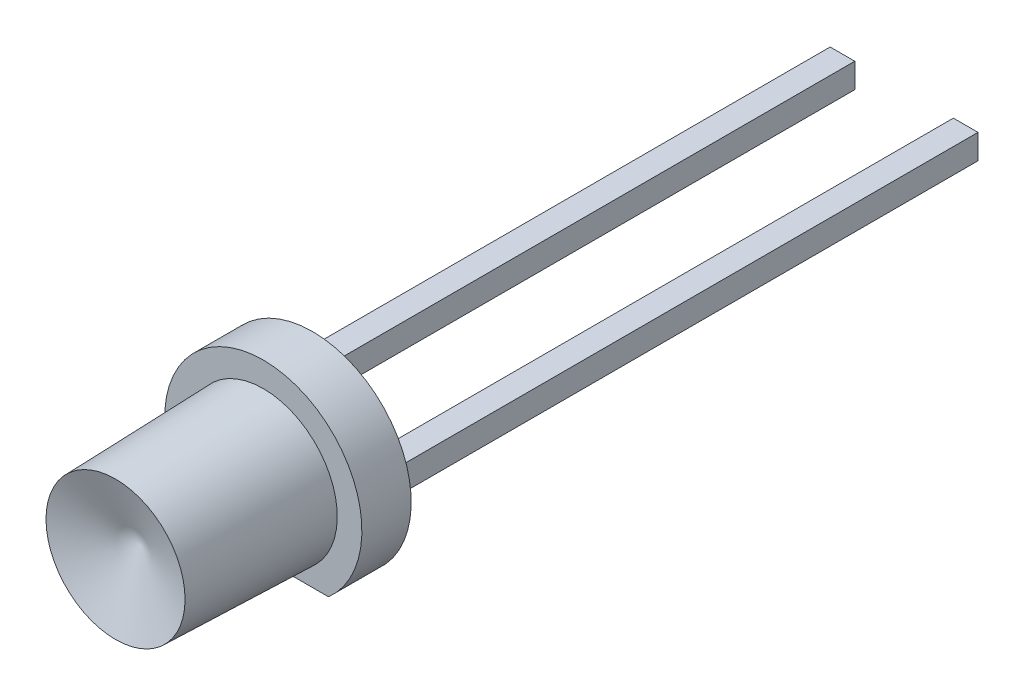
from build123d import *

# Parameters (mm, degrees)
BOSS_EXTRUDE1_DEPTH        = 10
BOSS_EXTRUDE1_DEPTH_BACK   = 2
SKETCH1_W                  = 0.5
SKETCH1_H                  = 0.5
BOSS_EXTRUDE1_2_DEPTH      = 10
BOSS_EXTRUDE1_2_DEPTH_BACK = 2
SKETCH2_R                  = 2
BOSS_EXTRUDE2_DEPTH        = 1
CUT_EXTRUDE1_DEPTH         = 3


with BuildPart() as part:
    # Sketch1 → Boss-Extrude1 (new, two sides: drawn at the far end of the back side and taken through both)
    with BuildSketch(Plane.XY.offset(-BOSS_EXTRUDE1_DEPTH_BACK)):
        with Locations((-0.25, -0.25)):
            Rectangle(SKETCH1_W, SKETCH1_H)
    extrude(amount=BOSS_EXTRUDE1_DEPTH + BOSS_EXTRUDE1_DEPTH_BACK)



with BuildPart() as body_2:
    # Sketch1 → Boss-Extrude1 2 (new, two sides: drawn at the far end of the back side and taken through both)
    with BuildSketch(Plane.XY.offset(-BOSS_EXTRUDE1_2_DEPTH_BACK)):
        with Locations((2.25, -0.25)):
            Rectangle(SKETCH1_W, SKETCH1_H)
    extrude(amount=BOSS_EXTRUDE1_2_DEPTH + BOSS_EXTRUDE1_2_DEPTH_BACK)


with BuildPart() as part_1:
    add(part.part)

    add(body_2.part)  # Boss-Extrude2 merges body 2
    # Sketch2 → Boss-Extrude2 (add)
    with BuildSketch(Plane.XY.offset(10)):
        with Locations((1, -0.25)):
            Circle(SKETCH2_R)
    extrude(amount=BOSS_EXTRUDE2_DEPTH)

    # Sketch5 → Cut-Extrude1 (cut)
    with BuildSketch(Plane(origin=(0, 0, 10), x_dir=(-1, 0, 0), z_dir=(0, 0, -1))):
        with BuildLine():
            Line((0.322875656, -1.75), (-1, -1.75))
            Line((-1, -1.75), (-2.322875656, -1.75))
            ThreePointArc((-2.322875656, -1.75), (-1, -2.25), (0.322875656, -1.75))
        make_face()
    extrude(amount=-CUT_EXTRUDE1_DEPTH, mode=Mode.SUBTRACT)

    # Sketch9 → Revolve6 (revolve)
    with BuildSketch(Plane(origin=(1, 0, 0), x_dir=(0, 0, -1), z_dir=(1, 0, 0))):
        Polygon((-13.5, -0.251884355), (-13.998669849, -1.662558347), (-11, -1.751884355), (-11, -0.251884355), align=None)
    revolve(axis=Axis((1, -0.251884355, 11), (0, 0, 1)))


solid = part_1.part
